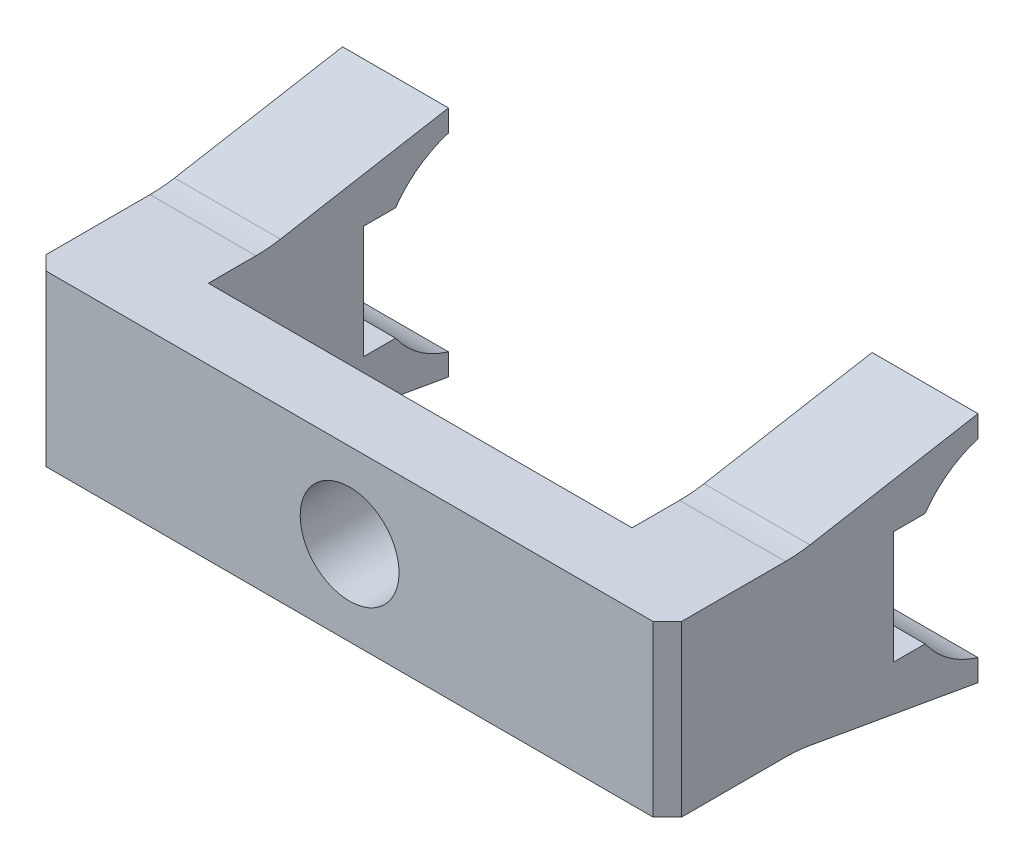
from build123d import *

# Parameters (mm, degrees)
SKETCH_1_W          = 45
SKETCH_1_H          = 12
EXTRUDE_1_DEPTH     = 5
EXTRUDE_2_DEPTH     = 7.5
SKETCH_9_R          = 3.5
CUT_EXTRUDE_1_DEPTH = 30.382179974
CHAMFER_1_SIZE      = 1


with BuildPart() as part:
    # 草图1 → 凸台-拉伸1 (new body)
    with BuildSketch(Plane.XY):
        Rectangle(SKETCH_1_W, SKETCH_1_H)
    extrude(amount=EXTRUDE_1_DEPTH)

    # 草图4 → 凸台-拉伸2 (add)
    with BuildSketch(Plane(origin=(22.5, 0, 0), x_dir=(0, 0, -1), z_dir=(1, 0, 0))):
        with BuildLine():
            Line((0, 6), (3.364729271, 6))
            ThreePointArc((3.364729271, 6), (4.236286698, 6.038053019), (5.101211047, 6.15192247))
            Line((5.101211047, 6.15192247), (17, 8.25))
            Line((17, 8.25), (17, 6.708203932))
            ThreePointArc((17, 6.708203932), (14.8977866, 5.672023027), (13.255437353, 4))
            Line((13.255437353, 4), (11, 4))
            Line((11, 4), (11, -4))
            Line((11, -4), (13.255437353, -4))
            ThreePointArc((13.255437353, -4), (14.8977866, -5.672023027), (17, -6.708203932))
            Line((17, -6.708203932), (17, -8.25))
            Line((17, -8.25), (5.101211047, -6.15192247))
            ThreePointArc((5.101211047, -6.15192247), (4.236286698, -6.038053019), (3.364729271, -6))
            Line((3.364729271, -6), (0, -6))
            Line((0, -6), (0, 6))
        make_face()
    extrude_2 = extrude(amount=-EXTRUDE_2_DEPTH)

    # 镜向1: 凸台-拉伸2 across plane
    add(extrude_2.mirror(Plane(origin=(0, 0, 0), x_dir=(0, 0, 1), z_dir=(1, 0, 0))))

    # 草图9 → 切除-拉伸1 (cut, through all)
    with BuildSketch(Plane(origin=(0, 0, 0), x_dir=(-1, 0, 0), z_dir=(0, 0, -1))):
        Circle(SKETCH_9_R)
    extrude(amount=-CUT_EXTRUDE_1_DEPTH, mode=Mode.SUBTRACT)

    # 草图12 → M6 螺纹孔1 (revolve, cut)
    with BuildSketch(Plane(origin=(19, 0, -11), x_dir=(0, 1, 0), z_dir=(1, 0, 0))):
        Polygon((0, 0), (0, 13.502151548), (2.5, 12), (2.5, 0), align=None)
    hole_wizard_m6_1 = revolve(axis=Axis((19, 0, -17.35), (0, 0, 1)), mode=Mode.SUBTRACT)

    # 镜向2: M6 螺纹孔1 across plane
    add(hole_wizard_m6_1.mirror(Plane(origin=(0, 0, 0), x_dir=(0, 0, 1), z_dir=(1, 0, 0))), mode=Mode.SUBTRACT)

    # 倒角1
    chamfer_1_edges = [part.edges().sort_by_distance(p)[0] for p in [
        (-22.5, 0, 5),
        (22.5, 0, 5),
    ]]
    chamfer(chamfer_1_edges, length=CHAMFER_1_SIZE)


solid = part.part
